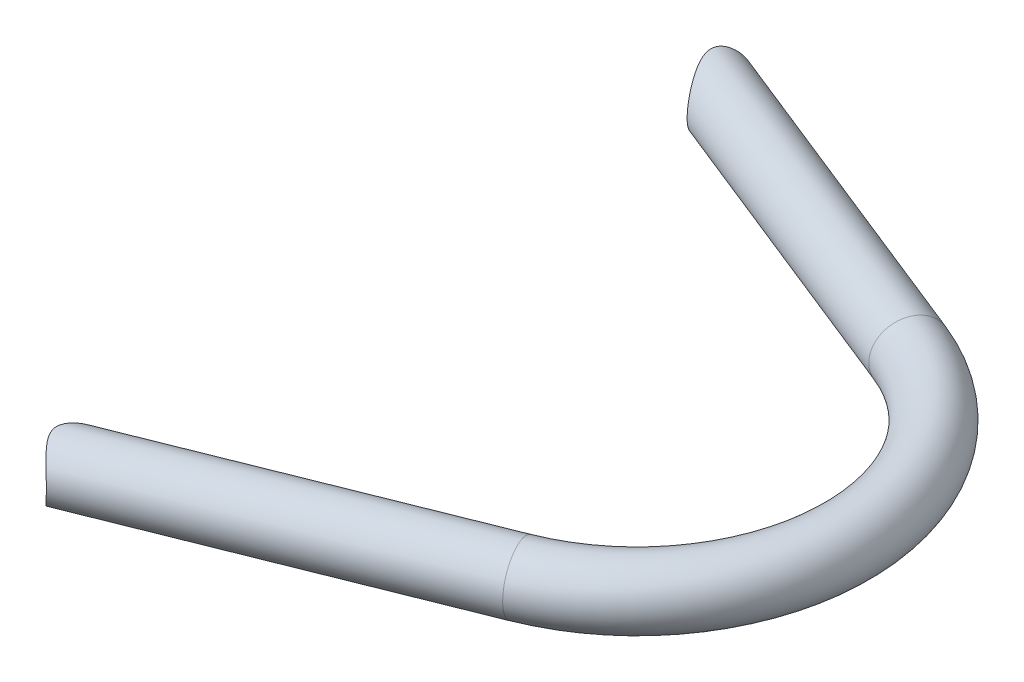
from build123d import *

# Parameters (mm, degrees)
SWEEP_THIN1_PROFILE_R   = 7.5
SWEEP_THIN1_PROFILE_R_2 = 5
CUT_EXTRUDE1_DEPTH      = 151.71883274
CUT_EXTRUDE1_DEPTH_BACK = 151.71883274
SKETCH7_R               = 9


with BuildPart() as part:
    # Sweep-Thin1: sweep along a path in Sketch2
    with BuildLine(Plane(origin=(0, 0, 0), x_dir=(1, 0, 0), z_dir=(0, 1, 0))) as sweep_thin1_path:
        Line((0, 80), (83.940413639, 46.423834544))
        ThreePointArc((83.940413639, 46.423834544), (115.370879822, 0), (83.940413639, -46.423834544))
        Line((83.940413639, -46.423834544), (0, -80))
    # Sweep-Thin1 profile (on start of the path) → Sweep-Thin1 (sweep)
    with BuildSketch(Plane(origin=(0, 0, -80), x_dir=(-0.37139067635410383, 0, 0.9284766908852594), z_dir=(0.9284766908852594, 0, 0.37139067635410383))):
        Circle(SWEEP_THIN1_PROFILE_R)
        Circle(SWEEP_THIN1_PROFILE_R_2, mode=Mode.SUBTRACT)
    sweep(path=sweep_thin1_path.line)

    # Sketch7 → Cut-Extrude1 (cut, two sides: drawn at the far end of the back side and taken through both)
    with BuildSketch(Plane.XY.offset(-CUT_EXTRUDE1_DEPTH_BACK)):
        Circle(SKETCH7_R)
    extrude(amount=CUT_EXTRUDE1_DEPTH + CUT_EXTRUDE1_DEPTH_BACK, mode=Mode.SUBTRACT)


solid = part.part
